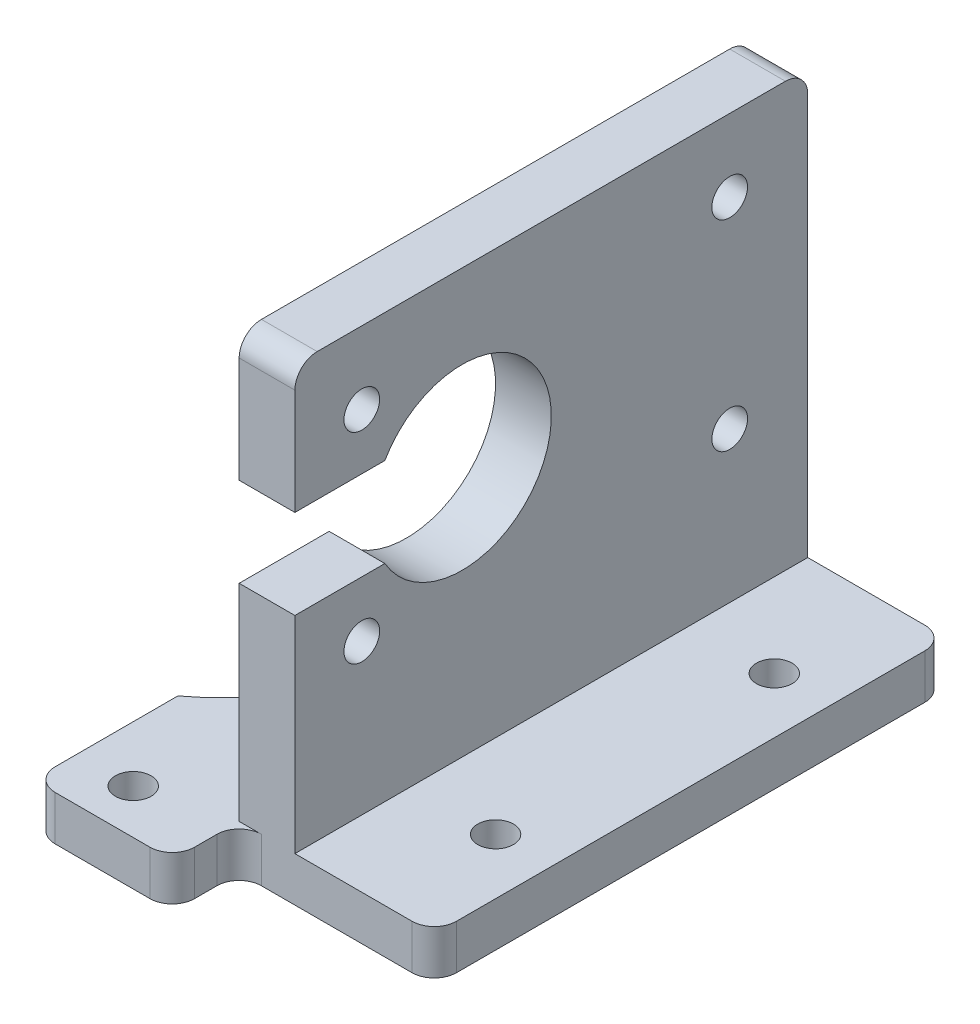
from build123d import *

# Parameters (mm, degrees)
SKETCH1_W           = 46
SKETCH1_H           = 32
SKETCH1_R           = 1.6
SKETCH1_R_2         = 8
EXTRUDE1_DEPTH      = 5
SKETCH2_W           = 10
SKETCH2_H           = 8
EXTRUDE2_DEPTH      = 29.460498942
EXTRUDE3_DEPTH      = 23
SKETCH4_R           = 1.6
EXTRUDE4_DEPTH      = 48.741491389
SKETCH_1_W          = 12.5
SKETCH_1_H          = 58
SKETCH_1_R          = 1.6
EXTRUDE_1_DEPTH     = 4
CUT_EXTRUDE_1_DEPTH = 10
FILLET_1_R          = 2


with BuildPart() as part:
    # Sketch1 → Extrude1 (new body)
    with BuildSketch(Plane(origin=(0, 0, 0), x_dir=(0, 0, -1), z_dir=(1, 0, 0))):
        Rectangle(SKETCH1_W, SKETCH1_H)
        with Locations((16, 9.5)):
            Circle(SKETCH1_R, mode=Mode.SUBTRACT)
        with Locations((-17, 9.5)):
            Circle(SKETCH1_R, mode=Mode.SUBTRACT)
        with Locations((-8, 0.5)):
            Circle(SKETCH1_R_2, mode=Mode.SUBTRACT)
        with Locations(Location((-17, -8.5, 0), (0, 0, 180))):
            Circle(SKETCH1_R, mode=Mode.SUBTRACT)
        with Locations(Location((16, -8.5, 0), (0, 0, 180))):
            Circle(SKETCH1_R, mode=Mode.SUBTRACT)
    extrude(amount=EXTRUDE1_DEPTH)

    # Sketch2 → Extrude2 (cut, through all)
    with BuildSketch(Plane(origin=(5, 0, 0), x_dir=(0, 0, -1), z_dir=(1, 0, 0))):
        with Locations((-18, 0.5)):
            Rectangle(SKETCH2_W, SKETCH2_H)
    extrude(amount=-EXTRUDE2_DEPTH, mode=Mode.SUBTRACT)

    # Sketch3 → Extrude3 (add, symmetric)
    with BuildSketch(Plane.XY):
        Polygon((0, -16), (0, -22), (-12.5, -22), (-12.5, -26), (17.5, -26), (17.5, -22), (5, -22), (5, -16), align=None)
    extrude(amount=EXTRUDE3_DEPTH, both=True)

    # Sketch4 → Extrude4 (cut, through all)
    with BuildSketch(Plane(origin=(0, -22, 0), x_dir=(1, 0, 0), z_dir=(0, 1, 0))):
        with Locations(Location((-7.5, -12.5, 0), (0, 0, 270))):
            Circle(SKETCH4_R)
        with Locations(Location((12.5, -12.5, 0), (0, 0, 90))):
            Circle(SKETCH4_R)
        with Locations(Location((-7.5, 12.5, 0), (0, 0, 90))):
            Circle(SKETCH4_R)
        with Locations(Location((12.5, 12.5, 0), (0, 0, 270))):
            Circle(SKETCH4_R)
    extrude(amount=-EXTRUDE4_DEPTH, mode=Mode.SUBTRACT)

    # 草图1 → 凸台-拉伸1 (add)
    with BuildSketch(Plane.XZ.offset(26)):
        with Locations((-6.25, 0)):
            Rectangle(SKETCH_1_W, SKETCH_1_H)
        with Locations((-7.5, -25)):
            Circle(SKETCH_1_R, mode=Mode.SUBTRACT)
        with Locations(Location((-7.5, 25, 0), (0, 0, 270))):
            Circle(SKETCH_1_R, mode=Mode.SUBTRACT)
    extrude(amount=-EXTRUDE_1_DEPTH)

    # 草图2 → 切除-拉伸1 (cut)
    with BuildSketch(Plane(origin=(0, -22, 0), x_dir=(1, 0, 0), z_dir=(0, 1, 0))):
        with BuildLine():
            Line((-12.5, 16), (-12.5, -16))
            ThreePointArc((-12.5, -16), (-4.5, 0), (-12.5, 16))
        make_face()
    extrude(amount=-CUT_EXTRUDE_1_DEPTH, mode=Mode.SUBTRACT)

    # 圆角1
    fillet_1_edges = [part.edges().sort_by_distance(p)[0] for p in [
        (0, -24, 29),
        (-12.5, -24, -29),
        (0, -24, -29),
        (0, -24, -23),
        (0, -24, 23),
        (-12.5, -24, 29),
        (17.5, -24, -23),
        (17.5, -24, 23),
        (2.5, 16, 23),
        (2.5, 16, -23),
    ]]
    fillet(fillet_1_edges, radius=FILLET_1_R)


solid = part.part
